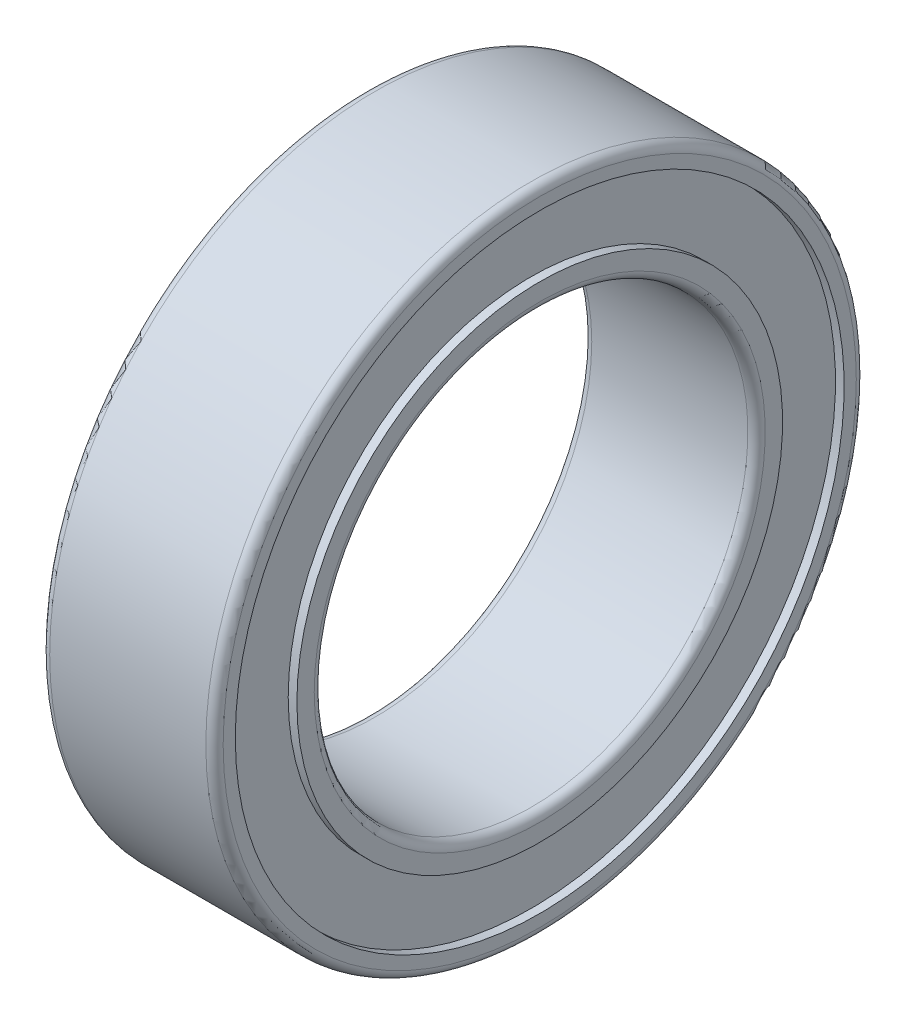
from build123d import *

# Parameters (mm, degrees)
FILLET1_R = 0.2
FILLET2_R = 0.2


with BuildPart() as part:
    # Sketch1 → Revolve1 (revolve)
    with BuildSketch(Plane.XY, mode=Mode.PRIVATE) as revolve1_sk:
        Polygon((0, 5), (4, 5), (4, 5.6), (3.8, 5.6), (3.8, 7.02), (4, 7.02), (4, 7.5), (0, 7.5), (0, 7.02), (0.2, 7.02), (0.2, 5.6), (0, 5.6), align=None)
    revolve(revolve1_sk.sketch.rotate(Axis((0, 0, 0), (1, 0, 0)), 90), axis=Axis((0, 0, 0), (1, 0, 0)))

    # Fillet1
    fillet1_edges = [part.edges().sort_by_distance(p)[0] for p in [
        (0, 0, -7.5),
        (4, 0, -7.5),
    ]]
    fillet(fillet1_edges, radius=FILLET1_R)

    # Fillet2
    fillet2_edges = [part.edges().sort_by_distance(p)[0] for p in [
        (4, 0, -5),
        (0, 0, -5),
    ]]
    fillet(fillet2_edges, radius=FILLET2_R)


solid = part.part
